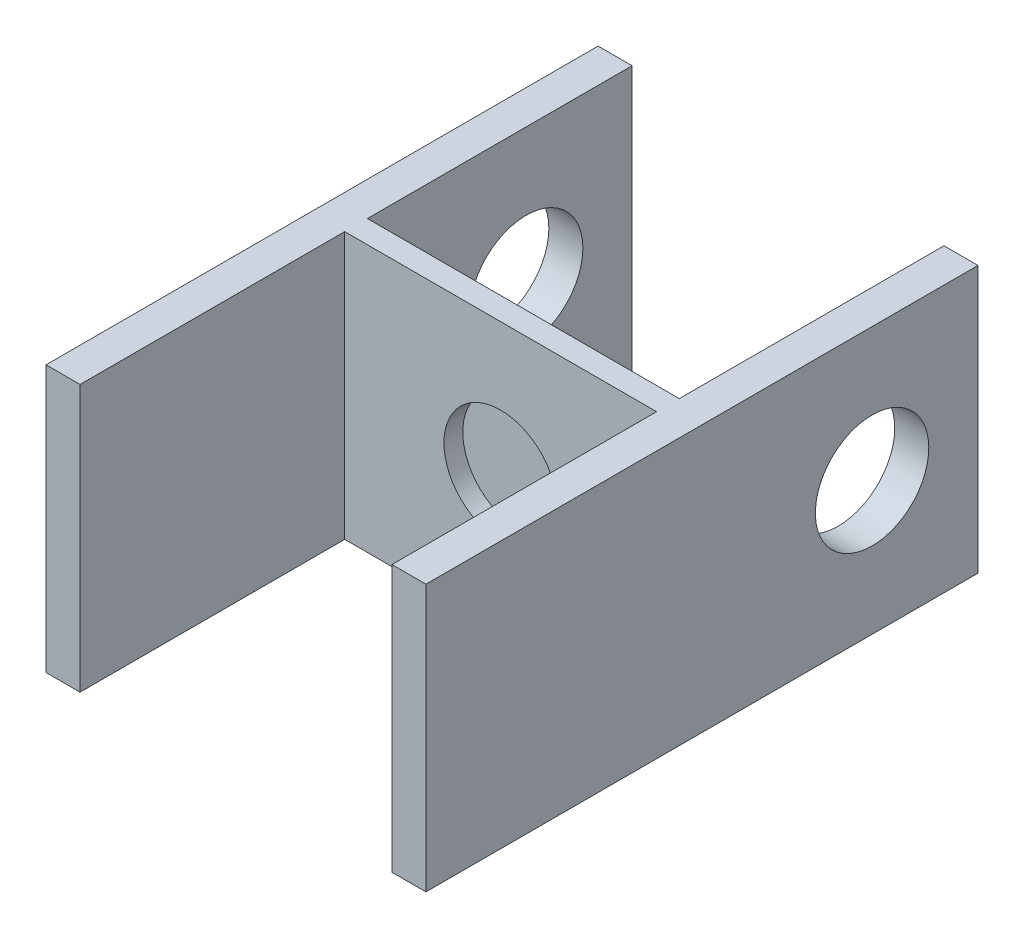
from build123d import *

# Parameters (mm, degrees)
BOSS_EXTRUDE2_DEPTH = 235
SKETCH2_R           = 50
CUT_EXTRUDE1_DEPTH  = 16.6
SKETCH4_R           = 50
CUT_EXTRUDE2_DEPTH  = 667.6
SCALE1_SCALE        = 0.75


with BuildPart() as part:
    # Sketch1 → Boss-Extrude2 (new body)
    with BuildSketch(Plane(origin=(0, 0, 0), x_dir=(1, 0, 0), z_dir=(0, 1, 0))):
        Polygon((-137.5, -243.4), (-167.5, -243.4), (-167.5, 243.4), (-137.5, 243.4), (-137.5, 10), (137.5, 10), (137.5, 243.4), (167.5, 243.4), (167.5, -243.4), (137.5, -243.4), (137.5, -10), (-137.5, -10), align=None)
    extrude(amount=BOSS_EXTRUDE2_DEPTH)

    # Sketch2 → Cut-Extrude1 (cut)
    with BuildSketch(Plane.XY.offset(10)):
        with Locations((0, 117.5)):
            Circle(SKETCH2_R)
    extrude(amount=-CUT_EXTRUDE1_DEPTH, mode=Mode.SUBTRACT)

    # Sketch4 → Cut-Extrude2 (cut)
    with BuildSketch(Plane(origin=(167.5, 0, 0), x_dir=(0, 0, -1), z_dir=(1, 0, 0))):
        with Locations((150, 117.5)):
            Circle(SKETCH4_R)
    extrude(amount=-CUT_EXTRUDE2_DEPTH, mode=Mode.SUBTRACT)


with BuildPart() as part_1:
    # Scale1: scaled about (0, 117.5, 9.327119411)
    add(part.part.scale(SCALE1_SCALE).moved(Location((0, 29.375, 2.331779853))))


solid = part_1.part
